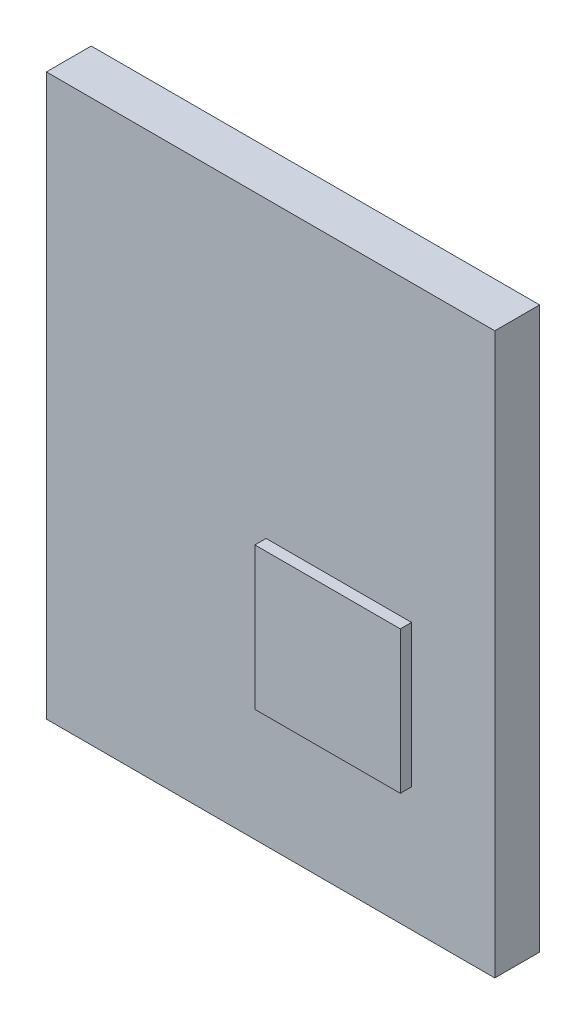
from build123d import *

# Parameters (mm, degrees)
SKETCH_1_W      = 20
SKETCH_1_H      = 25
EXTRUDE_1_DEPTH = 2
SKETCH_2_W      = 6.486749525
SKETCH_2_H      = 6.352255466
EXTRUDE_2_DEPTH = 0.5


with BuildPart() as part:
    # 草图1 → 凸台-拉伸1 (new body)
    with BuildSketch(Plane.XY):
        Rectangle(SKETCH_1_W, SKETCH_1_H)
    extrude(amount=EXTRUDE_1_DEPTH)

    # 草图2 → 凸台-拉伸2 (add)
    with BuildSketch(Plane.XY.offset(2)):
        with Locations((3.041945876, -3.797200132)):
            Rectangle(SKETCH_2_W, SKETCH_2_H)
    extrude(amount=EXTRUDE_2_DEPTH)


solid = part.part
